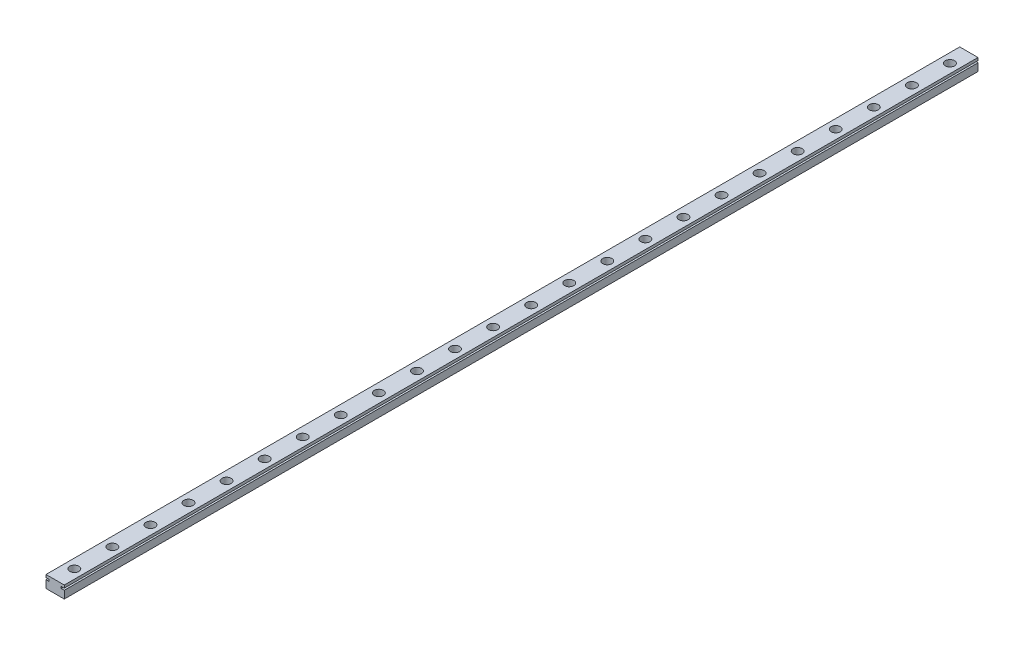
from build123d import *

# Parameters (mm, degrees)
BOSS_EXTRU_1_DEPTH      = 600
ESQUISSE2_R             = 3
ENL_V_MAT_EXTRU_1_DEPTH = 4.5
ENL_V_MAT_EXTRU_2_REACH = 602.095
ESQUISSE3_R             = 1.75


with BuildPart() as part:
    # Esquisse1 → Boss.-Extru.1 (new body)
    with BuildSketch(Plane.XY):
        Polygon((-2.287966089, -3.148854962), (9.712033911, -3.148854962), (9.712033911, 1.851145038), (7.712033911, 1.851145038), (7.712033911, 3.051145038), (9.712033911, 3.051145038), (9.712033911, 4.851145038), (-2.287966089, 4.851145038), (-2.287966089, 3.051145038), (-0.287966089, 3.051145038), (-0.287966089, 1.851145038), (-2.287966089, 1.851145038), align=None)
    extrude(amount=BOSS_EXTRU_1_DEPTH)

    # Esquisse2 → Enlèv. mat.-Extru.1 (cut)
    with BuildSketch(Plane(origin=(0, 4.851145038, 0), x_dir=(1, 0, 0), z_dir=(0, 1, 0))):
        with Locations(Location((3.792841972, -587.5, 0), (0, 0, 180))):
            Circle(ESQUISSE2_R)
        with Locations(Location((3.792841972, -562.5, 0), (0, 0, 180))):
            Circle(ESQUISSE2_R)
        with Locations(Location((3.792841972, -537.5, 0), (0, 0, 180))):
            Circle(ESQUISSE2_R)
        with Locations(Location((3.792841972, -512.5, 0), (0, 0, 180))):
            Circle(ESQUISSE2_R)
        with Locations(Location((3.792841972, -487.5, 0), (0, 0, 180))):
            Circle(ESQUISSE2_R)
        with Locations(Location((3.792841972, -462.5, 0), (0, 0, 180))):
            Circle(ESQUISSE2_R)
        with Locations(Location((3.792841972, -437.5, 0), (0, 0, 180))):
            Circle(ESQUISSE2_R)
        with Locations(Location((3.792841972, -412.5, 0), (0, 0, 180))):
            Circle(ESQUISSE2_R)
        with Locations(Location((3.792841972, -387.5, 0), (0, 0, 180))):
            Circle(ESQUISSE2_R)
        with Locations(Location((3.792841972, -362.5, 0), (0, 0, 180))):
            Circle(ESQUISSE2_R)
        with Locations(Location((3.792841972, -337.5, 0), (0, 0, 180))):
            Circle(ESQUISSE2_R)
        with Locations(Location((3.792841972, -312.5, 0), (0, 0, 180))):
            Circle(ESQUISSE2_R)
        with Locations(Location((3.792841972, -287.5, 0), (0, 0, 180))):
            Circle(ESQUISSE2_R)
        with Locations(Location((3.792841972, -262.5, 0), (0, 0, 180))):
            Circle(ESQUISSE2_R)
        with Locations(Location((3.792841972, -237.5, 0), (0, 0, 180))):
            Circle(ESQUISSE2_R)
        with Locations(Location((3.792841972, -212.5, 0), (0, 0, 180))):
            Circle(ESQUISSE2_R)
        with Locations(Location((3.792841972, -187.5, 0), (0, 0, 180))):
            Circle(ESQUISSE2_R)
        with Locations(Location((3.792841972, -162.5, 0), (0, 0, 180))):
            Circle(ESQUISSE2_R)
        with Locations(Location((3.792841972, -137.5, 0), (0, 0, 180))):
            Circle(ESQUISSE2_R)
        with Locations(Location((3.792841972, -112.5, 0), (0, 0, 180))):
            Circle(ESQUISSE2_R)
        with Locations(Location((3.792841972, -87.5, 0), (0, 0, 180))):
            Circle(ESQUISSE2_R)
        with Locations(Location((3.792841972, -62.5, 0), (0, 0, 180))):
            Circle(ESQUISSE2_R)
        with Locations(Location((3.792841972, -37.5, 0), (0, 0, 180))):
            Circle(ESQUISSE2_R)
        with Locations(Location((3.792841972, -12.5, 0), (0, 0, 180))):
            Circle(ESQUISSE2_R)
    extrude(amount=-ENL_V_MAT_EXTRU_1_DEPTH, mode=Mode.SUBTRACT)

    # Esquisse3 → Enlèv. mat.-Extru.2 (cut, up to next)
    with BuildSketch(Plane(origin=(0, 0.351145038, 0), x_dir=(1, 0, 0), z_dir=(0, 1, 0)), mode=Mode.PRIVATE) as enl_v_mat_extru_2_sk1:
        with Locations(Location((3.792841972, -587.5, 0), (0, 0, 180))):
            Circle(ESQUISSE3_R)
    enl_v_mat_extru_2_tool1 = extrude(enl_v_mat_extru_2_sk1.sketch, amount=-ENL_V_MAT_EXTRU_2_REACH, mode=Mode.PRIVATE) & part.part
    # Esquisse3 → Enlèv. mat.-Extru.2 (cut, up to next)
    with BuildSketch(Plane(origin=(0, 0.351145038, 0), x_dir=(1, 0, 0), z_dir=(0, 1, 0)), mode=Mode.PRIVATE) as enl_v_mat_extru_2_sk2:
        with Locations(Location((3.792841972, -562.5, 0), (0, 0, 180))):
            Circle(ESQUISSE3_R)
    enl_v_mat_extru_2_tool2 = extrude(enl_v_mat_extru_2_sk2.sketch, amount=-ENL_V_MAT_EXTRU_2_REACH, mode=Mode.PRIVATE) & part.part
    # Esquisse3 → Enlèv. mat.-Extru.2 (cut, up to next)
    with BuildSketch(Plane(origin=(0, 0.351145038, 0), x_dir=(1, 0, 0), z_dir=(0, 1, 0)), mode=Mode.PRIVATE) as enl_v_mat_extru_2_sk3:
        with Locations(Location((3.792841972, -537.5, 0), (0, 0, 180))):
            Circle(ESQUISSE3_R)
    enl_v_mat_extru_2_tool3 = extrude(enl_v_mat_extru_2_sk3.sketch, amount=-ENL_V_MAT_EXTRU_2_REACH, mode=Mode.PRIVATE) & part.part
    # Esquisse3 → Enlèv. mat.-Extru.2 (cut, up to next)
    with BuildSketch(Plane(origin=(0, 0.351145038, 0), x_dir=(1, 0, 0), z_dir=(0, 1, 0)), mode=Mode.PRIVATE) as enl_v_mat_extru_2_sk4:
        with Locations(Location((3.792841972, -512.5, 0), (0, 0, 180))):
            Circle(ESQUISSE3_R)
    enl_v_mat_extru_2_tool4 = extrude(enl_v_mat_extru_2_sk4.sketch, amount=-ENL_V_MAT_EXTRU_2_REACH, mode=Mode.PRIVATE) & part.part
    # Esquisse3 → Enlèv. mat.-Extru.2 (cut, up to next)
    with BuildSketch(Plane(origin=(0, 0.351145038, 0), x_dir=(1, 0, 0), z_dir=(0, 1, 0)), mode=Mode.PRIVATE) as enl_v_mat_extru_2_sk5:
        with Locations(Location((3.792841972, -487.5, 0), (0, 0, 180))):
            Circle(ESQUISSE3_R)
    enl_v_mat_extru_2_tool5 = extrude(enl_v_mat_extru_2_sk5.sketch, amount=-ENL_V_MAT_EXTRU_2_REACH, mode=Mode.PRIVATE) & part.part
    # Esquisse3 → Enlèv. mat.-Extru.2 (cut, up to next)
    with BuildSketch(Plane(origin=(0, 0.351145038, 0), x_dir=(1, 0, 0), z_dir=(0, 1, 0)), mode=Mode.PRIVATE) as enl_v_mat_extru_2_sk6:
        with Locations(Location((3.792841972, -462.5, 0), (0, 0, 180))):
            Circle(ESQUISSE3_R)
    enl_v_mat_extru_2_tool6 = extrude(enl_v_mat_extru_2_sk6.sketch, amount=-ENL_V_MAT_EXTRU_2_REACH, mode=Mode.PRIVATE) & part.part
    # Esquisse3 → Enlèv. mat.-Extru.2 (cut, up to next)
    with BuildSketch(Plane(origin=(0, 0.351145038, 0), x_dir=(1, 0, 0), z_dir=(0, 1, 0)), mode=Mode.PRIVATE) as enl_v_mat_extru_2_sk7:
        with Locations(Location((3.792841972, -437.5, 0), (0, 0, 180))):
            Circle(ESQUISSE3_R)
    enl_v_mat_extru_2_tool7 = extrude(enl_v_mat_extru_2_sk7.sketch, amount=-ENL_V_MAT_EXTRU_2_REACH, mode=Mode.PRIVATE) & part.part
    # Esquisse3 → Enlèv. mat.-Extru.2 (cut, up to next)
    with BuildSketch(Plane(origin=(0, 0.351145038, 0), x_dir=(1, 0, 0), z_dir=(0, 1, 0)), mode=Mode.PRIVATE) as enl_v_mat_extru_2_sk8:
        with Locations(Location((3.792841972, -412.5, 0), (0, 0, 180))):
            Circle(ESQUISSE3_R)
    enl_v_mat_extru_2_tool8 = extrude(enl_v_mat_extru_2_sk8.sketch, amount=-ENL_V_MAT_EXTRU_2_REACH, mode=Mode.PRIVATE) & part.part
    # Esquisse3 → Enlèv. mat.-Extru.2 (cut, up to next)
    with BuildSketch(Plane(origin=(0, 0.351145038, 0), x_dir=(1, 0, 0), z_dir=(0, 1, 0)), mode=Mode.PRIVATE) as enl_v_mat_extru_2_sk9:
        with Locations(Location((3.792841972, -387.5, 0), (0, 0, 180))):
            Circle(ESQUISSE3_R)
    enl_v_mat_extru_2_tool9 = extrude(enl_v_mat_extru_2_sk9.sketch, amount=-ENL_V_MAT_EXTRU_2_REACH, mode=Mode.PRIVATE) & part.part
    # Esquisse3 → Enlèv. mat.-Extru.2 (cut, up to next)
    with BuildSketch(Plane(origin=(0, 0.351145038, 0), x_dir=(1, 0, 0), z_dir=(0, 1, 0)), mode=Mode.PRIVATE) as enl_v_mat_extru_2_sk10:
        with Locations(Location((3.792841972, -362.5, 0), (0, 0, 180))):
            Circle(ESQUISSE3_R)
    enl_v_mat_extru_2_tool10 = extrude(enl_v_mat_extru_2_sk10.sketch, amount=-ENL_V_MAT_EXTRU_2_REACH, mode=Mode.PRIVATE) & part.part
    # Esquisse3 → Enlèv. mat.-Extru.2 (cut, up to next)
    with BuildSketch(Plane(origin=(0, 0.351145038, 0), x_dir=(1, 0, 0), z_dir=(0, 1, 0)), mode=Mode.PRIVATE) as enl_v_mat_extru_2_sk11:
        with Locations(Location((3.792841972, -337.5, 0), (0, 0, 180))):
            Circle(ESQUISSE3_R)
    enl_v_mat_extru_2_tool11 = extrude(enl_v_mat_extru_2_sk11.sketch, amount=-ENL_V_MAT_EXTRU_2_REACH, mode=Mode.PRIVATE) & part.part
    # Esquisse3 → Enlèv. mat.-Extru.2 (cut, up to next)
    with BuildSketch(Plane(origin=(0, 0.351145038, 0), x_dir=(1, 0, 0), z_dir=(0, 1, 0)), mode=Mode.PRIVATE) as enl_v_mat_extru_2_sk12:
        with Locations(Location((3.792841972, -312.5, 0), (0, 0, 180))):
            Circle(ESQUISSE3_R)
    enl_v_mat_extru_2_tool12 = extrude(enl_v_mat_extru_2_sk12.sketch, amount=-ENL_V_MAT_EXTRU_2_REACH, mode=Mode.PRIVATE) & part.part
    # Esquisse3 → Enlèv. mat.-Extru.2 (cut, up to next)
    with BuildSketch(Plane(origin=(0, 0.351145038, 0), x_dir=(1, 0, 0), z_dir=(0, 1, 0)), mode=Mode.PRIVATE) as enl_v_mat_extru_2_sk13:
        with Locations(Location((3.792841972, -287.5, 0), (0, 0, 180))):
            Circle(ESQUISSE3_R)
    enl_v_mat_extru_2_tool13 = extrude(enl_v_mat_extru_2_sk13.sketch, amount=-ENL_V_MAT_EXTRU_2_REACH, mode=Mode.PRIVATE) & part.part
    # Esquisse3 → Enlèv. mat.-Extru.2 (cut, up to next)
    with BuildSketch(Plane(origin=(0, 0.351145038, 0), x_dir=(1, 0, 0), z_dir=(0, 1, 0)), mode=Mode.PRIVATE) as enl_v_mat_extru_2_sk14:
        with Locations(Location((3.792841972, -262.5, 0), (0, 0, 180))):
            Circle(ESQUISSE3_R)
    enl_v_mat_extru_2_tool14 = extrude(enl_v_mat_extru_2_sk14.sketch, amount=-ENL_V_MAT_EXTRU_2_REACH, mode=Mode.PRIVATE) & part.part
    # Esquisse3 → Enlèv. mat.-Extru.2 (cut, up to next)
    with BuildSketch(Plane(origin=(0, 0.351145038, 0), x_dir=(1, 0, 0), z_dir=(0, 1, 0)), mode=Mode.PRIVATE) as enl_v_mat_extru_2_sk15:
        with Locations(Location((3.792841972, -237.5, 0), (0, 0, 180))):
            Circle(ESQUISSE3_R)
    enl_v_mat_extru_2_tool15 = extrude(enl_v_mat_extru_2_sk15.sketch, amount=-ENL_V_MAT_EXTRU_2_REACH, mode=Mode.PRIVATE) & part.part
    # Esquisse3 → Enlèv. mat.-Extru.2 (cut, up to next)
    with BuildSketch(Plane(origin=(0, 0.351145038, 0), x_dir=(1, 0, 0), z_dir=(0, 1, 0)), mode=Mode.PRIVATE) as enl_v_mat_extru_2_sk16:
        with Locations(Location((3.792841972, -212.5, 0), (0, 0, 180))):
            Circle(ESQUISSE3_R)
    enl_v_mat_extru_2_tool16 = extrude(enl_v_mat_extru_2_sk16.sketch, amount=-ENL_V_MAT_EXTRU_2_REACH, mode=Mode.PRIVATE) & part.part
    # Esquisse3 → Enlèv. mat.-Extru.2 (cut, up to next)
    with BuildSketch(Plane(origin=(0, 0.351145038, 0), x_dir=(1, 0, 0), z_dir=(0, 1, 0)), mode=Mode.PRIVATE) as enl_v_mat_extru_2_sk17:
        with Locations(Location((3.792841972, -187.5, 0), (0, 0, 180))):
            Circle(ESQUISSE3_R)
    enl_v_mat_extru_2_tool17 = extrude(enl_v_mat_extru_2_sk17.sketch, amount=-ENL_V_MAT_EXTRU_2_REACH, mode=Mode.PRIVATE) & part.part
    # Esquisse3 → Enlèv. mat.-Extru.2 (cut, up to next)
    with BuildSketch(Plane(origin=(0, 0.351145038, 0), x_dir=(1, 0, 0), z_dir=(0, 1, 0)), mode=Mode.PRIVATE) as enl_v_mat_extru_2_sk18:
        with Locations(Location((3.792841972, -162.5, 0), (0, 0, 180))):
            Circle(ESQUISSE3_R)
    enl_v_mat_extru_2_tool18 = extrude(enl_v_mat_extru_2_sk18.sketch, amount=-ENL_V_MAT_EXTRU_2_REACH, mode=Mode.PRIVATE) & part.part
    # Esquisse3 → Enlèv. mat.-Extru.2 (cut, up to next)
    with BuildSketch(Plane(origin=(0, 0.351145038, 0), x_dir=(1, 0, 0), z_dir=(0, 1, 0)), mode=Mode.PRIVATE) as enl_v_mat_extru_2_sk19:
        with Locations(Location((3.792841972, -137.5, 0), (0, 0, 180))):
            Circle(ESQUISSE3_R)
    enl_v_mat_extru_2_tool19 = extrude(enl_v_mat_extru_2_sk19.sketch, amount=-ENL_V_MAT_EXTRU_2_REACH, mode=Mode.PRIVATE) & part.part
    # Esquisse3 → Enlèv. mat.-Extru.2 (cut, up to next)
    with BuildSketch(Plane(origin=(0, 0.351145038, 0), x_dir=(1, 0, 0), z_dir=(0, 1, 0)), mode=Mode.PRIVATE) as enl_v_mat_extru_2_sk20:
        with Locations(Location((3.792841972, -112.5, 0), (0, 0, 180))):
            Circle(ESQUISSE3_R)
    enl_v_mat_extru_2_tool20 = extrude(enl_v_mat_extru_2_sk20.sketch, amount=-ENL_V_MAT_EXTRU_2_REACH, mode=Mode.PRIVATE) & part.part
    # Esquisse3 → Enlèv. mat.-Extru.2 (cut, up to next)
    with BuildSketch(Plane(origin=(0, 0.351145038, 0), x_dir=(1, 0, 0), z_dir=(0, 1, 0)), mode=Mode.PRIVATE) as enl_v_mat_extru_2_sk21:
        with Locations(Location((3.792841972, -87.5, 0), (0, 0, 180))):
            Circle(ESQUISSE3_R)
    enl_v_mat_extru_2_tool21 = extrude(enl_v_mat_extru_2_sk21.sketch, amount=-ENL_V_MAT_EXTRU_2_REACH, mode=Mode.PRIVATE) & part.part
    # Esquisse3 → Enlèv. mat.-Extru.2 (cut, up to next)
    with BuildSketch(Plane(origin=(0, 0.351145038, 0), x_dir=(1, 0, 0), z_dir=(0, 1, 0)), mode=Mode.PRIVATE) as enl_v_mat_extru_2_sk22:
        with Locations(Location((3.792841972, -62.5, 0), (0, 0, 180))):
            Circle(ESQUISSE3_R)
    enl_v_mat_extru_2_tool22 = extrude(enl_v_mat_extru_2_sk22.sketch, amount=-ENL_V_MAT_EXTRU_2_REACH, mode=Mode.PRIVATE) & part.part
    # Esquisse3 → Enlèv. mat.-Extru.2 (cut, up to next)
    with BuildSketch(Plane(origin=(0, 0.351145038, 0), x_dir=(1, 0, 0), z_dir=(0, 1, 0)), mode=Mode.PRIVATE) as enl_v_mat_extru_2_sk23:
        with Locations(Location((3.792841972, -37.5, 0), (0, 0, 180))):
            Circle(ESQUISSE3_R)
    enl_v_mat_extru_2_tool23 = extrude(enl_v_mat_extru_2_sk23.sketch, amount=-ENL_V_MAT_EXTRU_2_REACH, mode=Mode.PRIVATE) & part.part
    # Esquisse3 → Enlèv. mat.-Extru.2 (cut, up to next)
    with BuildSketch(Plane(origin=(0, 0.351145038, 0), x_dir=(1, 0, 0), z_dir=(0, 1, 0)), mode=Mode.PRIVATE) as enl_v_mat_extru_2_sk24:
        with Locations(Location((3.792841972, -12.5, 0), (0, 0, 180))):
            Circle(ESQUISSE3_R)
    enl_v_mat_extru_2_tool24 = extrude(enl_v_mat_extru_2_sk24.sketch, amount=-ENL_V_MAT_EXTRU_2_REACH, mode=Mode.PRIVATE) & part.part
    add(enl_v_mat_extru_2_tool1.solids().sort_by_distance((3.792842, 0.351145, 587.5))[0], mode=Mode.SUBTRACT)
    add(enl_v_mat_extru_2_tool2.solids().sort_by_distance((3.792842, 0.351145, 562.5))[0], mode=Mode.SUBTRACT)
    add(enl_v_mat_extru_2_tool3.solids().sort_by_distance((3.792842, 0.351145, 537.5))[0], mode=Mode.SUBTRACT)
    add(enl_v_mat_extru_2_tool4.solids().sort_by_distance((3.792842, 0.351145, 512.5))[0], mode=Mode.SUBTRACT)
    add(enl_v_mat_extru_2_tool5.solids().sort_by_distance((3.792842, 0.351145, 487.5))[0], mode=Mode.SUBTRACT)
    add(enl_v_mat_extru_2_tool6.solids().sort_by_distance((3.792842, 0.351145, 462.5))[0], mode=Mode.SUBTRACT)
    add(enl_v_mat_extru_2_tool7.solids().sort_by_distance((3.792842, 0.351145, 437.5))[0], mode=Mode.SUBTRACT)
    add(enl_v_mat_extru_2_tool8.solids().sort_by_distance((3.792842, 0.351145, 412.5))[0], mode=Mode.SUBTRACT)
    add(enl_v_mat_extru_2_tool9.solids().sort_by_distance((3.792842, 0.351145, 387.5))[0], mode=Mode.SUBTRACT)
    add(enl_v_mat_extru_2_tool10.solids().sort_by_distance((3.792842, 0.351145, 362.5))[0], mode=Mode.SUBTRACT)
    add(enl_v_mat_extru_2_tool11.solids().sort_by_distance((3.792842, 0.351145, 337.5))[0], mode=Mode.SUBTRACT)
    add(enl_v_mat_extru_2_tool12.solids().sort_by_distance((3.792842, 0.351145, 312.5))[0], mode=Mode.SUBTRACT)
    add(enl_v_mat_extru_2_tool13.solids().sort_by_distance((3.792842, 0.351145, 287.5))[0], mode=Mode.SUBTRACT)
    add(enl_v_mat_extru_2_tool14.solids().sort_by_distance((3.792842, 0.351145, 262.5))[0], mode=Mode.SUBTRACT)
    add(enl_v_mat_extru_2_tool15.solids().sort_by_distance((3.792842, 0.351145, 237.5))[0], mode=Mode.SUBTRACT)
    add(enl_v_mat_extru_2_tool16.solids().sort_by_distance((3.792842, 0.351145, 212.5))[0], mode=Mode.SUBTRACT)
    add(enl_v_mat_extru_2_tool17.solids().sort_by_distance((3.792842, 0.351145, 187.5))[0], mode=Mode.SUBTRACT)
    add(enl_v_mat_extru_2_tool18.solids().sort_by_distance((3.792842, 0.351145, 162.5))[0], mode=Mode.SUBTRACT)
    add(enl_v_mat_extru_2_tool19.solids().sort_by_distance((3.792842, 0.351145, 137.5))[0], mode=Mode.SUBTRACT)
    add(enl_v_mat_extru_2_tool20.solids().sort_by_distance((3.792842, 0.351145, 112.5))[0], mode=Mode.SUBTRACT)
    add(enl_v_mat_extru_2_tool21.solids().sort_by_distance((3.792842, 0.351145, 87.5))[0], mode=Mode.SUBTRACT)
    add(enl_v_mat_extru_2_tool22.solids().sort_by_distance((3.792842, 0.351145, 62.5))[0], mode=Mode.SUBTRACT)
    add(enl_v_mat_extru_2_tool23.solids().sort_by_distance((3.792842, 0.351145, 37.5))[0], mode=Mode.SUBTRACT)
    add(enl_v_mat_extru_2_tool24.solids().sort_by_distance((3.792842, 0.351145, 12.5))[0], mode=Mode.SUBTRACT)


solid = part.part
